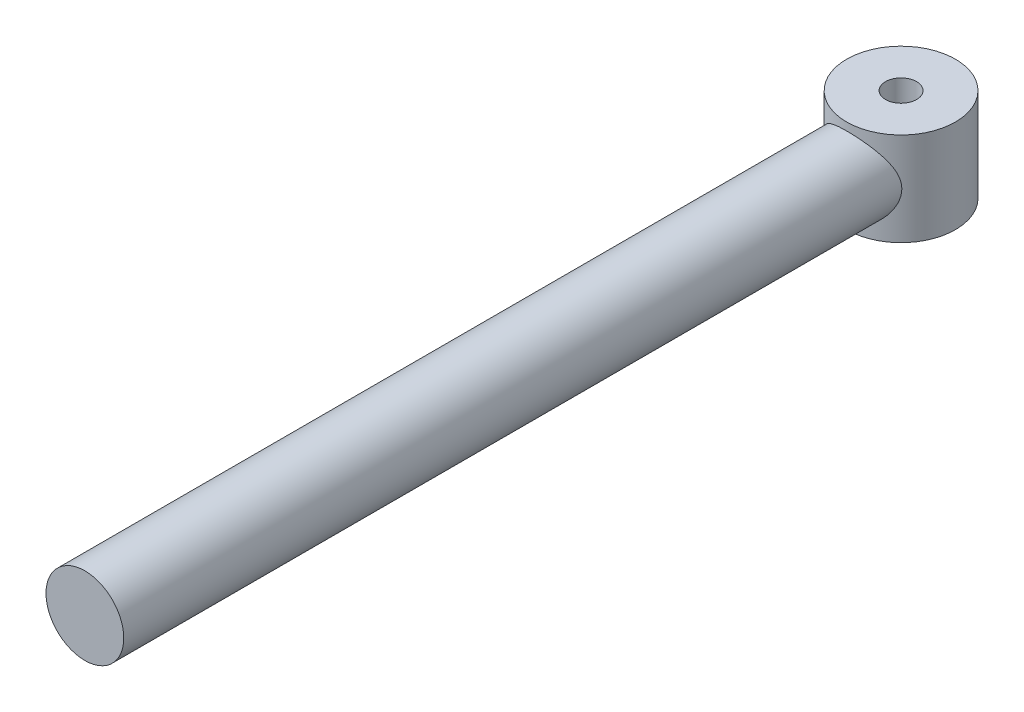
from build123d import *

# Parameters (mm, degrees)
SKETCH1_R               = 25
BOSS_EXTRUDE1_DEPTH     = 525
SKETCH2_R               = 35
SKETCH2_R_2             = 10
BOSS_EXTRUDE2_DEPTH     = 30
CUT_EXTRUDE1_DEPTH      = 528.019923834
CUT_EXTRUDE1_DEPTH_BACK = 528.019923834
SKETCH2_2_R             = 10


with BuildPart() as part:
    # Sketch1 → Boss-Extrude1 (new body)
    with BuildSketch(Plane.XY):
        Circle(SKETCH1_R)
    extrude(amount=BOSS_EXTRUDE1_DEPTH)

    # Sketch2 → Boss-Extrude2 (add, symmetric)
    with BuildSketch(Plane(origin=(0, 0, 0), x_dir=(1, 0, 0), z_dir=(0, 1, 0))):
        Circle(SKETCH2_R)
        Circle(SKETCH2_R_2, mode=Mode.SUBTRACT)
    extrude(amount=BOSS_EXTRUDE2_DEPTH, both=True)

    # Sketch2<2> → Cut-Extrude1 (cut, two sides: drawn at the far end of the back side and taken through both)
    with BuildSketch(Plane(origin=(0, 0, 0), x_dir=(1, 0, 0), z_dir=(0, 1, 0)).offset(-CUT_EXTRUDE1_DEPTH_BACK)):
        Circle(SKETCH2_2_R)
    extrude(amount=CUT_EXTRUDE1_DEPTH + CUT_EXTRUDE1_DEPTH_BACK, mode=Mode.SUBTRACT)


solid = part.part
